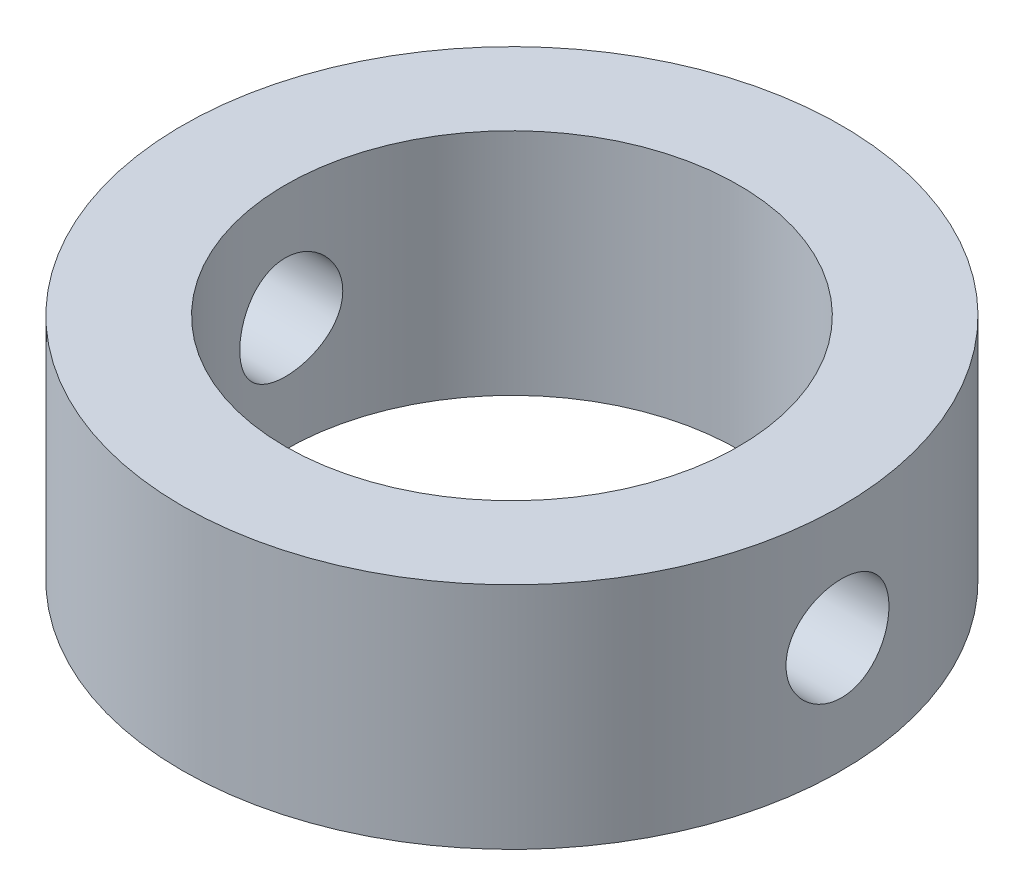
from build123d import *

# Parameters (mm, degrees)
SKETCH1_W               = 5
SKETCH1_H               = 11.126009642
CUT_EXTRUDE1_DEPTH      = 24.30122363
CUT_EXTRUDE1_DEPTH_BACK = 24.30122363
SKETCH2_R               = 2.5


with BuildPart() as part:
    # Sketch1 → Revolve1 (revolve)
    with BuildSketch(Plane.XY, mode=Mode.PRIVATE) as revolve1_sk:
        with Locations((-13.5, 0)):
            Rectangle(SKETCH1_W, SKETCH1_H)
    revolve(revolve1_sk.sketch.rotate(Axis((0, 18.45504774, 0), (0, -1, 0)), 270), axis=Axis((0, 18.45504774, 0), (0, -1, 0)))

    # Sketch2 → Cut-Extrude1 (cut, two sides: drawn at the far end of the back side and taken through both)
    with BuildSketch(Plane(origin=(0, 0, 0), x_dir=(0, 0, -1), z_dir=(1, 0, 0)).offset(-CUT_EXTRUDE1_DEPTH_BACK)):
        Circle(SKETCH2_R)
    extrude(amount=CUT_EXTRUDE1_DEPTH + CUT_EXTRUDE1_DEPTH_BACK, mode=Mode.SUBTRACT)


solid = part.part
